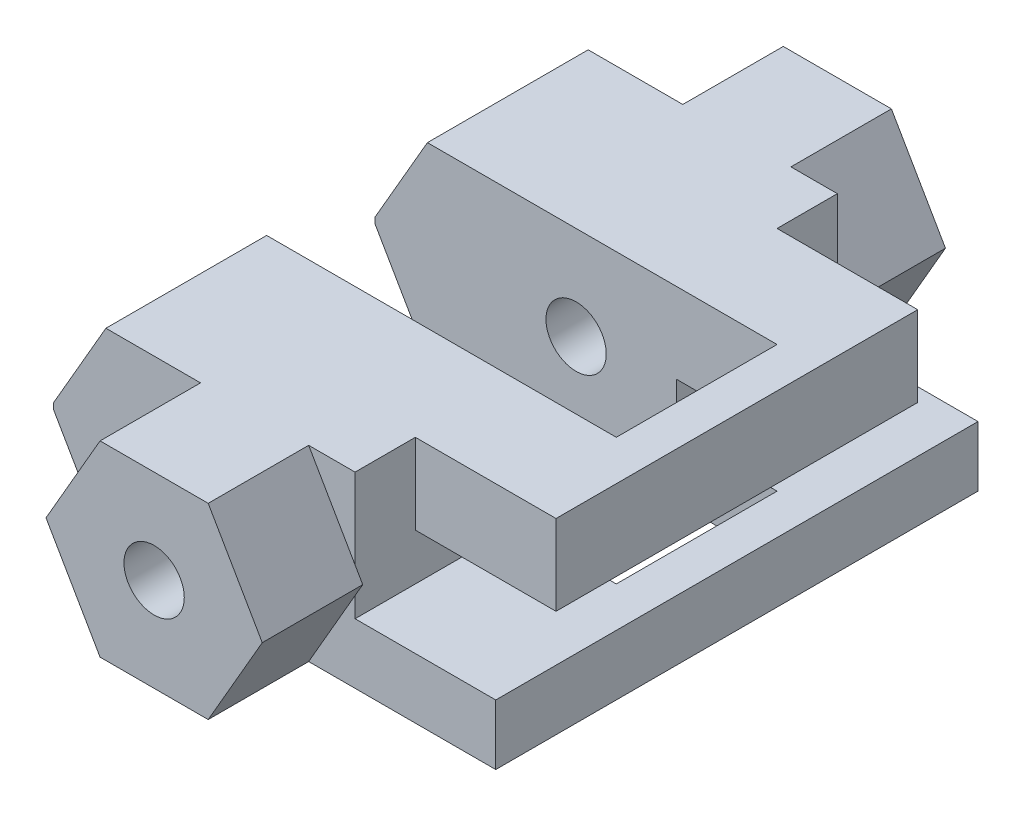
from build123d import *
from OCP.BRepFilletAPI import BRepFilletAPI_MakeChamfer
from build123d.topology import SkipClean

# Parameters (mm, degrees)
ESQUISSE1_R             = 1.5
BOSS_EXTRU_1_DEPTH      = 5
BOSS_EXTRU_3_START      = 8
ESQUISSE3_R             = 1.5
BOSS_EXTRU_3_DEPTH      = 8
ESQUISSE4_W             = 2
ESQUISSE4_H             = 4
ESQUISSE4_H_2           = 3
BOSS_EXTRU_4_DEPTH      = 4
ESQUISSE5_W             = 7
ESQUISSE5_H             = 3
ENL_V_MAT_EXTRU_1_DEPTH = 4
CHANFREIN2_SIZE         = 4.5
CHANFREIN2_SIZE2        = 2.6
CHANFREIN3_SIZE         = 2.6
CHANFREIN3_SIZE2        = 4.5


with BuildPart() as part:
    # Esquisse1 → Boss.-Extru.1 (new body)
    with BuildSketch(Plane.XY):
        Polygon((2.690598923, 4.660254038), (-2.690598923, 4.660254038), (-5.381197846, 0), (-2.690598923, -4.660254038), (2.690598923, -4.660254038), (5.381197846, 0), align=None)
        Circle(ESQUISSE1_R, mode=Mode.SUBTRACT)
    boss_extru_1 = extrude(amount=BOSS_EXTRU_1_DEPTH)

    # Esquisse3 → Boss.-Extru.3 (add)
    with SkipClean():  # the faces are left unmerged after this step: merging them gives an invalid solid
        with BuildSketch(Plane(origin=(0, 0, 0), x_dir=(-1, 0, 0), z_dir=(0, 0, -1)).offset(BOSS_EXTRU_3_START)):
            Polygon((-12, 4.660254038), (10, 4.660254038), (10, -4.660254038), (-12, -4.660254038), (-12, -1.660254038), (-5, -1.660254038), (-5, 0.660254038), (-12, 0.660254038), align=None)
            Circle(ESQUISSE3_R, mode=Mode.SUBTRACT)
        boss_extru_3 = extrude(amount=-BOSS_EXTRU_3_DEPTH)

    # Esquisse4 → Boss.-Extru.4 (add)
    with SkipClean():  # the faces are left unmerged after this step: merging them gives an invalid solid
        with BuildSketch(Plane(origin=(0, 0, -8), x_dir=(-1, 0, 0), z_dir=(0, 0, -1))):
            with Locations((-11, 2.660254038)):
                Rectangle(ESQUISSE4_W, ESQUISSE4_H)
            with Locations((-11, -3.160254038)):
                Rectangle(ESQUISSE4_W, ESQUISSE4_H_2)
        boss_extru_4 = extrude(amount=BOSS_EXTRU_4_DEPTH)

    # Esquisse5 → Enlèv. mat.-Extru.1 (cut)
    with SkipClean():  # the faces are left unmerged after this step: merging them gives an invalid solid
        with BuildSketch(Plane(origin=(0, 4.660254038, 0), x_dir=(1, 0, 0), z_dir=(0, 1, 0))):
            with Locations((8.5, 1.5)):
                Rectangle(ESQUISSE5_W, ESQUISSE5_H)
        enl_v_mat_extru_1 = extrude(amount=-ENL_V_MAT_EXTRU_1_DEPTH, mode=Mode.SUBTRACT)

    # Symétrie3: Boss.-Extru.1, Boss.-Extru.3, Boss.-Extru.4, Enlèv. mat.-Extru.1 across plane
    with SkipClean():  # the faces are left unmerged after this step: merging them gives an invalid solid
        add(boss_extru_1.mirror(Plane.XY.offset(-12)))
        add(boss_extru_3.mirror(Plane.XY.offset(-12)))
        add(boss_extru_4.mirror(Plane.XY.offset(-12)))
        add(enl_v_mat_extru_1.mirror(Plane.XY.offset(-12)), mode=Mode.SUBTRACT)

    # Chanfrein2: one chamfer whose edges measure the first distance from different faces: ONE call of the kernel's chamfer builder (chamfer() names one face for all edges)
    chanfrein2_edges_1 = [part.edges().sort_by_distance(p)[0] for p in [
        (-10, 4.660254038, -4),
    ]]
    chanfrein2_side_1 = [part.faces().sort_by_distance(p)[0] for p in [
        (-10, 0, -4),
    ]]
    chanfrein2_edges_2 = [part.edges().sort_by_distance(p)[0] for p in [
        (-10, -4.660254038, -20),
    ]]
    chanfrein2_side_2 = [part.faces().sort_by_distance(p)[0] for p in [
        (-10, 0, -20),
    ]]
    chanfrein2 = BRepFilletAPI_MakeChamfer(part.part.solid().wrapped)
    for e in chanfrein2_edges_1:
        chanfrein2.Add(CHANFREIN2_SIZE, CHANFREIN2_SIZE2, e.wrapped, chanfrein2_side_1[0].wrapped)  # the first distance lies on this face
    for e in chanfrein2_edges_2:
        chanfrein2.Add(CHANFREIN2_SIZE, CHANFREIN2_SIZE2, e.wrapped, chanfrein2_side_2[0].wrapped)  # the first distance lies on this face
    add(Compound.cast(chanfrein2.Shape()), mode=Mode.REPLACE)

    # Chanfrein3: one chamfer whose edges measure the first distance from different faces: ONE call of the kernel's chamfer builder (chamfer() names one face for all edges)
    chanfrein3_edges_1 = [part.edges().sort_by_distance(p)[0] for p in [
        (-10, -4.660254038, -4),
    ]]
    chanfrein3_side_1 = [part.faces().sort_by_distance(p)[0] for p in [
        (1.3, -4.660254038, -16.404969135),
    ]]
    chanfrein3_edges_2 = [part.edges().sort_by_distance(p)[0] for p in [
        (-10, 4.660254038, -20),
    ]]
    chanfrein3_side_2 = [part.faces().sort_by_distance(p)[0] for p in [
        (-5.045299462, 4.660254038, -0.404969135),
    ]]
    chanfrein3 = BRepFilletAPI_MakeChamfer(part.part.solid().wrapped)
    for e in chanfrein3_edges_1:
        chanfrein3.Add(CHANFREIN3_SIZE, CHANFREIN3_SIZE2, e.wrapped, chanfrein3_side_1[0].wrapped)  # the first distance lies on this face
    for e in chanfrein3_edges_2:
        chanfrein3.Add(CHANFREIN3_SIZE, CHANFREIN3_SIZE2, e.wrapped, chanfrein3_side_2[0].wrapped)  # the first distance lies on this face
    add(Compound.cast(chanfrein3.Shape()), mode=Mode.REPLACE)


solid = part.part
